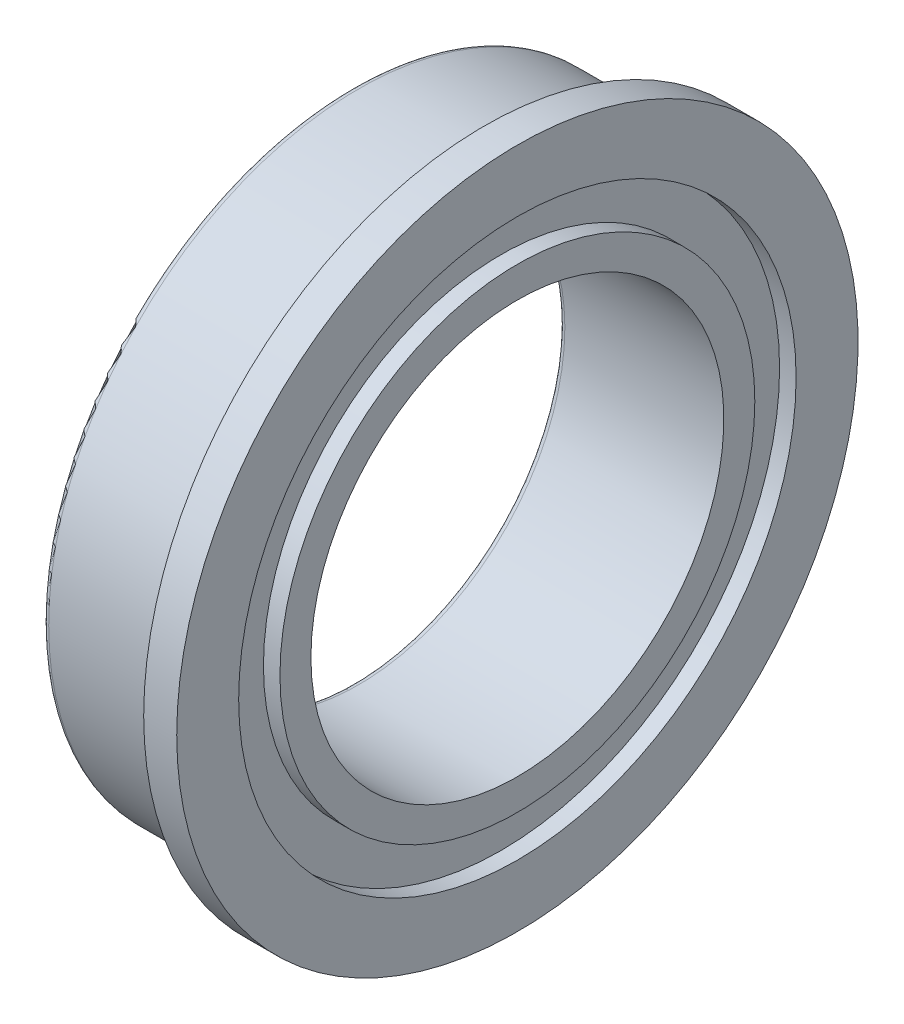
from build123d import *

# Parameters (mm, degrees)
FILLET1_R = 0.15


with BuildPart() as part:
    # Sketch1 → Revolve1 (revolve)
    with BuildSketch(Plane.XY, mode=Mode.PRIVATE) as revolve1_sk:
        Polygon((2, 8.25), (1.2, 8.25), (1.2, 7.5), (-2, 7.5), (-2, 6.75), (-1.6, 6.75), (-1.6, 5.75), (-2, 5.75), (-2, 5), (2, 5), (2, 5.75), (1.6, 5.75), (1.6, 6.75), (2, 6.75), align=None)
    revolve(revolve1_sk.sketch.rotate(Axis((-243.027564124, 0, 0), (1, 0, 0)), 90), axis=Axis((-243.027564124, 0, 0), (1, 0, 0)))

    # Fillet1
    fillet1_edges = [part.edges().sort_by_distance(p)[0] for p in [
        (-2, 0, -5),
        (-2, 0, -7.5),
    ]]
    fillet(fillet1_edges, radius=FILLET1_R)


solid = part.part
